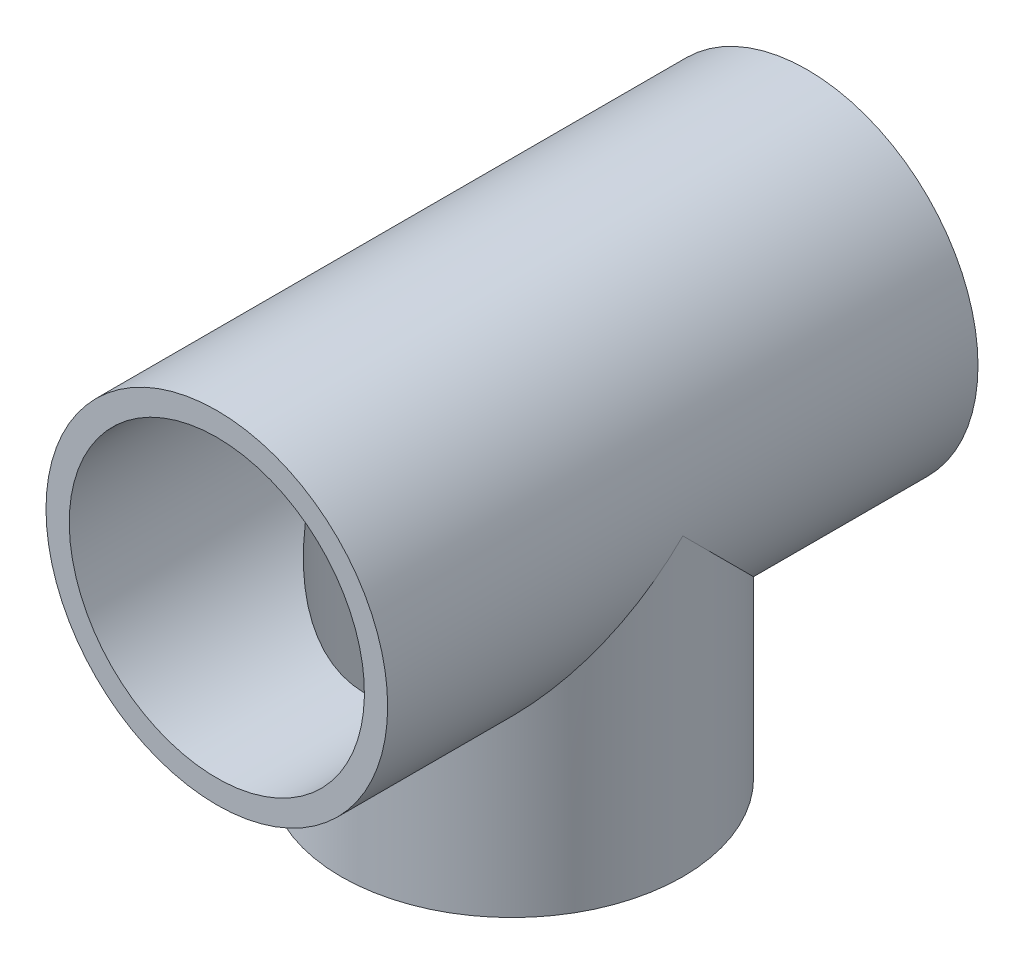
from build123d import *

# Parameters (mm, degrees)
TUBE_PROFILE_R          = 7.35
TUBE_PROFILE_R_2        = 6.35
EXTRUDE_THIN_REACH      = 31.111
EXTRUDE_THIN_END_RADIUS = 7.35
EXTRUDE_THIN_START      = -12.7
PROFILE_R               = 7.35
PROFILE_R_2             = 6.35
CUT_EXTRUDE_START       = -7.35
PROFILE_2_R             = 6.35
CUT_EXTRUDE_DEPTH       = 7.35


with BuildPart() as part:
    # Tube: sweep along a path in Path
    with BuildLine(Plane(origin=(0, 0, 0), x_dir=(0, 0, -1), z_dir=(1, 0, 0))) as tube_path:
        Line((-12.7, 0), (12.7, 0))
    # Tube profile (on start of the path) → Tube (sweep)
    with BuildSketch(Plane(origin=(0, 0, 12.7), x_dir=(0, -1, 0), z_dir=(0, 0, -1))):
        Circle(TUBE_PROFILE_R)
        Circle(TUBE_PROFILE_R_2, mode=Mode.SUBTRACT)
    sweep(path=tube_path.line)

    # Extrude-Thin: up to this cylinder (the profile starts outside it)
    extrude_thin_end = Plane(origin=(0, 0, 0), z_dir=(0, 0, -1)) * Cylinder(EXTRUDE_THIN_END_RADIUS, 77.922, mode=Mode.PRIVATE)
    # Profile → Extrude-Thin (add, up to the surface)
    with BuildSketch(Plane(origin=(0, 0, 0), x_dir=(1, 0, 0), z_dir=(0, 1, 0)).offset(EXTRUDE_THIN_START), mode=Mode.PRIVATE) as extrude_thin_sk1:
        Circle(PROFILE_R)
        Circle(PROFILE_R_2, mode=Mode.SUBTRACT)
    extrude_thin_tool1 = extrude(extrude_thin_sk1.sketch, amount=EXTRUDE_THIN_REACH, mode=Mode.PRIVATE) - extrude_thin_end
    add(extrude_thin_tool1.solids().sort_by_distance((-7.142111, -12.7, 0))[0])

    # Profile<2> → Cut-Extrude (cut)
    with BuildSketch(Plane(origin=(0, 0, 0), x_dir=(1, 0, 0), z_dir=(0, 1, 0)).offset(CUT_EXTRUDE_START)):
        with Locations(Location((0, 0, 0), (0, 0, 180))):
            Circle(PROFILE_2_R)
    extrude(amount=CUT_EXTRUDE_DEPTH, mode=Mode.SUBTRACT)


solid = part.part
